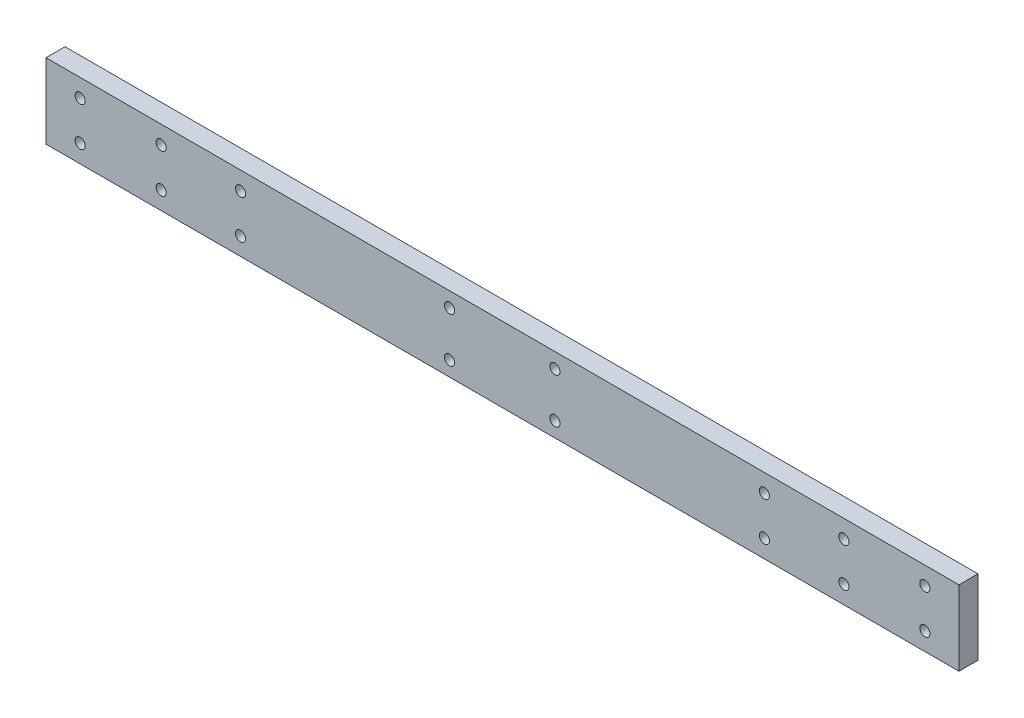
from build123d import *

# Parameters (mm, degrees)
SKETCH1_W           = 304.8
SKETCH1_H           = 25
BOSS_EXTRUDE1_DEPTH = 6.35
SKETCH2_R           = 1.7
CUT_EXTRUDE1_DEPTH  = 10
SKETCH3_R           = 1.7
CUT_EXTRUDE2_DEPTH  = 22


with BuildPart() as part:
    # Sketch1 → Boss-Extrude1 (new body)
    with BuildSketch(Plane.XY):
        with Locations((111.623766163, 223.42362241)):
            Rectangle(SKETCH1_W, SKETCH1_H)
    extrude(amount=BOSS_EXTRUDE1_DEPTH)

    # Sketch2 → Cut-Extrude1 (cut)
    with BuildSketch(Plane.XY.offset(6.35)):
        with Locations((225.573766163, 216.92362241)):
            Circle(SKETCH2_R)
        with Locations((225.573766163, 229.92362241)):
            Circle(SKETCH2_R)
        with Locations((252.623766163, 229.92362241)):
            Circle(SKETCH2_R)
        with Locations((252.623766163, 216.92362241)):
            Circle(SKETCH2_R)
        with Locations((-2.326233837, 216.92362241)):
            Circle(SKETCH2_R)
        with Locations((-29.376233837, 216.92362241)):
            Circle(SKETCH2_R)
        with Locations((-29.376233837, 229.92362241)):
            Circle(SKETCH2_R)
        with Locations((-2.326233837, 229.92362241)):
            Circle(SKETCH2_R)
    extrude(amount=-CUT_EXTRUDE1_DEPTH, mode=Mode.SUBTRACT)

    # Sketch3 → Cut-Extrude2 (cut)
    with BuildSketch(Plane.XY.offset(6.35)):
        with Locations((225.573766163, 216.92362241)):
            Circle(SKETCH3_R)
        with Locations((225.573766163, 229.92362241)):
            Circle(SKETCH3_R)
        with Locations((199.050473293, 216.92362241)):
            Circle(SKETCH3_R)
        with Locations((199.050473293, 229.92362241)):
            Circle(SKETCH3_R)
        with Locations((129.123766163, 215.92362241)):
            Circle(SKETCH3_R)
        with Locations((129.123766163, 230.92362241)):
            Circle(SKETCH3_R)
        with Locations((93.960167873, 215.92362241)):
            Circle(SKETCH3_R)
        with Locations((93.960167873, 230.92362241)):
            Circle(SKETCH3_R)
        with Locations((24.196928947, 229.840552731)):
            Circle(SKETCH3_R)
        with Locations((24.156213572, 216.84061649)):
            Circle(SKETCH3_R)
    extrude(amount=-CUT_EXTRUDE2_DEPTH, mode=Mode.SUBTRACT)


solid = part.part
